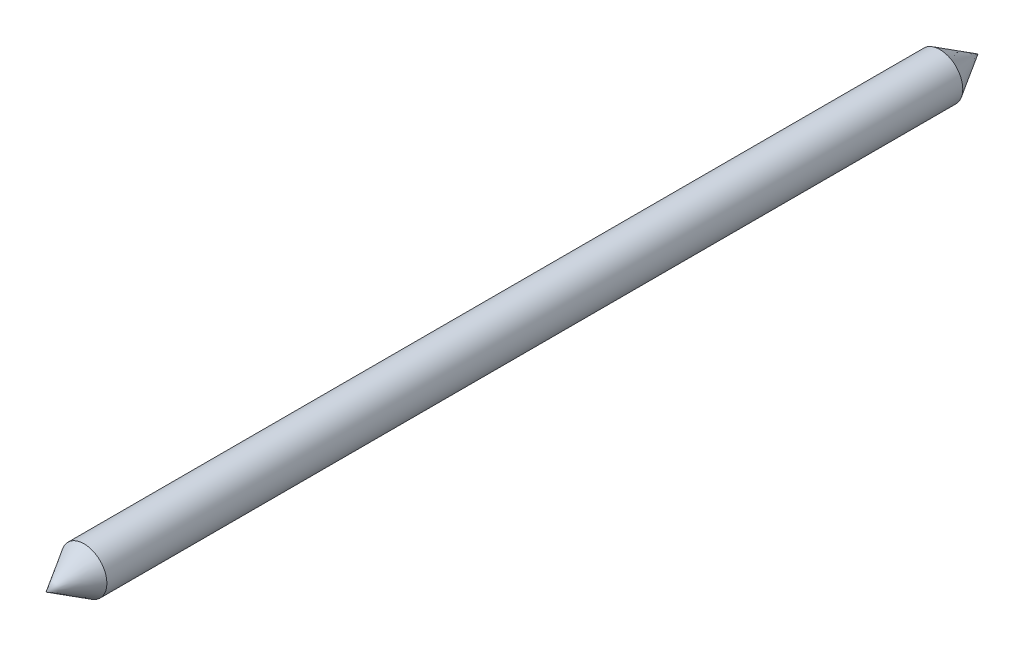
from build123d import *


with BuildPart() as part:
    # Sketch1 → Revolve1 (revolve)
    with BuildSketch(Plane(origin=(0, 0, 0), x_dir=(1, 0, 0), z_dir=(0, 1, 0)), mode=Mode.PRIVATE) as revolve1_sk:
        Polygon((0, 155.575), (7.62, 142.875), (7.62, -142.875), (0, -155.575), align=None)
    revolve(revolve1_sk.sketch.rotate(Axis((0, 0, -155.575), (0, 0, 1)), 180), axis=Axis((0, 0, -155.575), (0, 0, 1)))


solid = part.part
